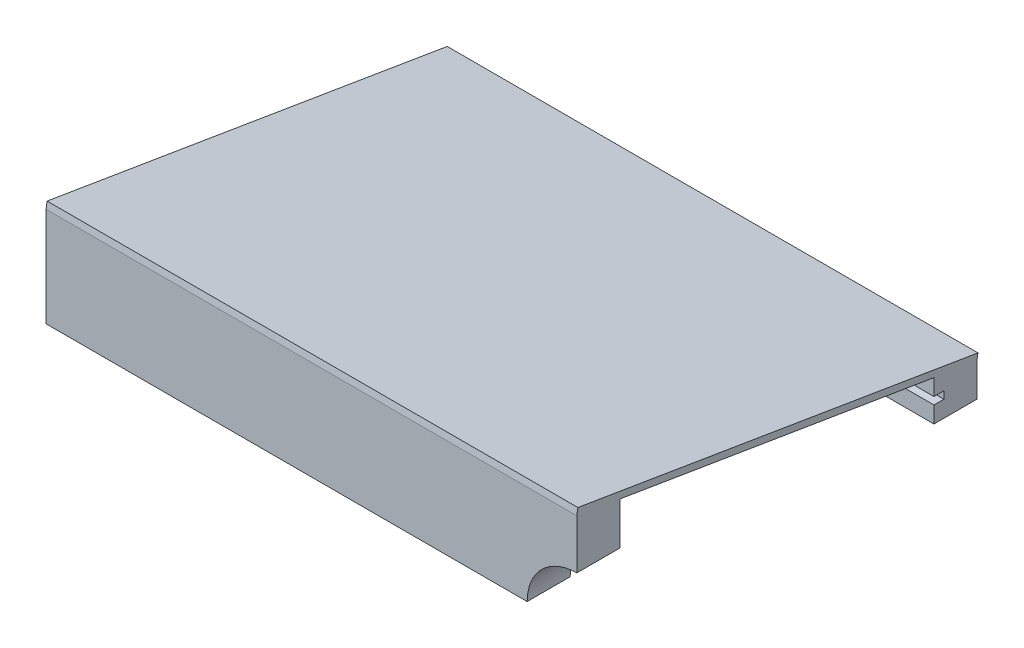
from build123d import *

# Parameters (mm, degrees)
BOSS_EXTRUDE1_DEPTH = 30
SKETCH2_W           = 101
SKETCH2_H           = 2.2
CUT_EXTRUDE1_DEPTH  = 160
CUT_EXTRUDE2_DEPTH  = 108
CUT_EXTRUDE3_DEPTH  = 202
SKETCH6_W           = 165
SKETCH6_H           = 122.641754717
BOSS_EXTRUDE2_DEPTH = 2
SKETCH7_R           = 15
CUT_EXTRUDE4_DEPTH  = 22
CUT_EXTRUDE5_DEPTH  = 4.5
CUT_EXTRUDE6_DEPTH  = 21.5


with BuildPart() as part:
    # Sketch1 → Boss-Extrude1 (new body)
    with BuildSketch(Plane(origin=(0, 0, 0), x_dir=(1, 0, 0), z_dir=(0, 1, 0))):
        Polygon((-7.912176277, -15.186960462), (-7.912176277, 79.813039538), (148.087823723, 79.813039538), (148.087823723, 92.813039538), (-16.912176277, 92.813039538), (-16.912176277, -28.186960462), (148.087823723, -28.186960462), (148.087823723, -15.186960462), align=None)
    extrude(amount=BOSS_EXTRUDE1_DEPTH)

    # Sketch2 → Cut-Extrude1 (cut)
    with BuildSketch(Plane(origin=(148.087823723, 0, 0), x_dir=(0, 0, -1), z_dir=(1, 0, 0))):
        with Locations((32.313039538, 6.1)):
            Rectangle(SKETCH2_W, SKETCH2_H)
    extrude(amount=-CUT_EXTRUDE1_DEPTH, mode=Mode.SUBTRACT)

    # Sketch4 → Cut-Extrude2 (cut)
    with BuildSketch(Plane.XZ.offset(-7.2)):
        Polygon((-7.912176277, 15.186960462), (-11.910877917, 15.186960462), (-11.910877917, -79.815923725), (-7.912176277, -79.813039538), align=None)
    extrude(amount=CUT_EXTRUDE2_DEPTH, mode=Mode.SUBTRACT)

    # Sketch5 → Cut-Extrude3 (cut)
    with BuildSketch(Plane.ZY.offset(16.912176277)):
        Polygon((-92.813039538, 10), (-92.813039538, 30), (28.186960462, 30), align=None)
    extrude(amount=-CUT_EXTRUDE3_DEPTH, mode=Mode.SUBTRACT)

    # Sketch6 → Boss-Extrude2 (add)
    with BuildSketch(Plane(origin=(0, 24.667080359, -4.077203365), x_dir=(1, 0, 0), z_dir=(0, 0.986613411390535, -0.16307659692405538))):
        with Locations((65.587823723, 28.618946233)):
            Rectangle(SKETCH6_W, SKETCH6_H)
    extrude(amount=BOSS_EXTRUDE2_DEPTH)

    # Sketch7 → Cut-Extrude4 (cut)
    with BuildSketch(Plane.XY.offset(28.186960462)):
        with Locations((148.087823723, 0)):
            Circle(SKETCH7_R)
    extrude(amount=-CUT_EXTRUDE4_DEPTH, mode=Mode.SUBTRACT)

    # Sketch8 → Cut-Extrude5 (cut)
    with BuildSketch(Plane(origin=(148.087823723, 0, 0), x_dir=(0, 0, -1), z_dir=(1, 0, 0))):
        Polygon((-28.186960462, 30), (-28.186960462, 0), (92.813039538, 0), (92.813039538, 10), (93.139192732, 11.973226823), (-27.860807268, 31.973226823), align=None)
    extrude(amount=-CUT_EXTRUDE5_DEPTH, mode=Mode.SUBTRACT)

    # Sketch9 → Cut-Extrude6 (cut)
    with BuildSketch(Plane.XY.offset(28.186960462)):
        with BuildLine():
            Line((133.087823723, 0), (143.587823723, 0))
            Line((143.587823723, 0), (143.587823723, 14.309088021))
            Line((143.587823723, 14.309088021), (143.587823723, 15))
            ThreePointArc((143.587823723, 15), (132.981222005, 10.606601718), (128.587823723, 0))
            Line((128.587823723, 0), (133.087823723, 0))
        make_face()
    extrude(amount=-CUT_EXTRUDE6_DEPTH, mode=Mode.SUBTRACT)


solid = part.part
